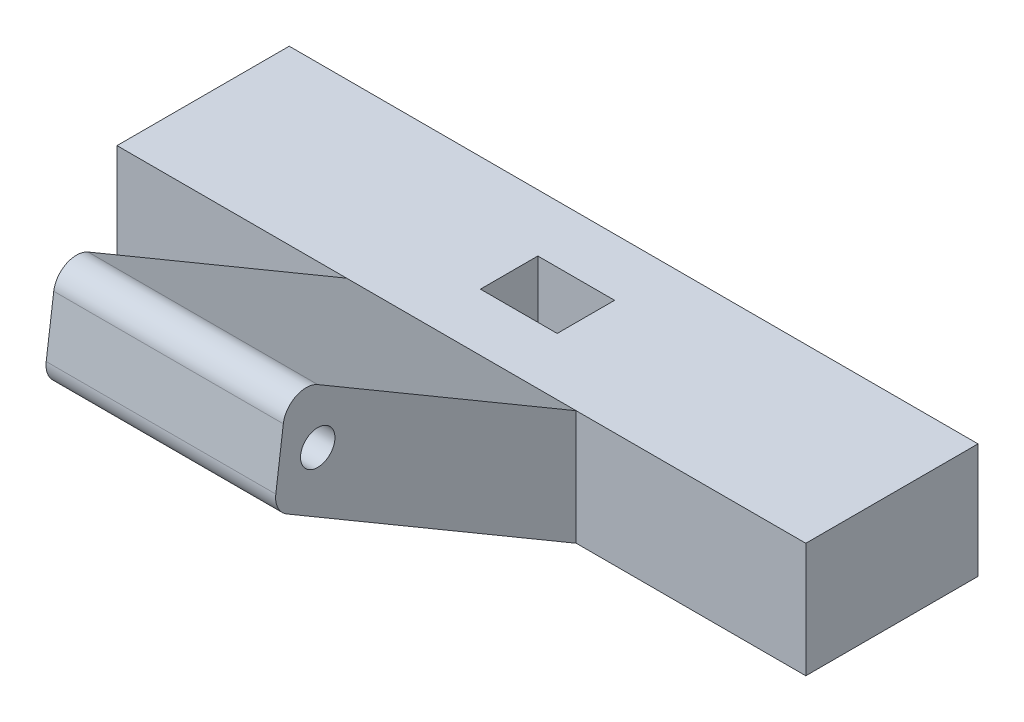
from build123d import *

# Parameters (mm, degrees)
ESQUISSE1_W             = 60
ESQUISSE1_H             = 15
ESQUISSE1_R             = 3.64432939
BOSS_EXTRU_2_DEPTH      = 10
BOSS_EXTRU_3_DEPTH      = 10
BOSS_EXTRU_3_DEPTH_BACK = 10
ESQUISSE2_R             = 1.5
ESQUISSE3_W             = 6.68566512
ESQUISSE3_H             = 5
ENL_V_MAT_EXTRU_1_DEPTH = 10
BOSS_EXTRU_5_DEPTH      = 10


with BuildPart() as part:
    # Esquisse1 → Boss.-Extru.2 (new body)
    with BuildSketch(Plane(origin=(0, 0, 0), x_dir=(1, 0, 0), z_dir=(0, 1, 0))):
        Rectangle(ESQUISSE1_W, ESQUISSE1_H)
        with Locations(Location((0, 0, 0), (0, 0, 270))):
            Circle(ESQUISSE1_R, mode=Mode.SUBTRACT)
    extrude(amount=BOSS_EXTRU_2_DEPTH)

    # Esquisse2 → Boss.-Extru.3 (add, two sides: drawn at the far end of the back side and taken through both)
    with BuildSketch(Plane(origin=(0, 0, 0), x_dir=(0, 0, -1), z_dir=(1, 0, 0)).offset(-BOSS_EXTRU_3_DEPTH_BACK)):
        with BuildLine():
            Line((-7.5, 0), (-32.699931919, 14.80760574))
            ThreePointArc((-32.699931919, 14.80760574), (-33.484005092, 15.654628224), (-33.66947754, 16.793846289))
            Line((-33.66947754, 16.793846289), (-33.012420508, 21.768308704))
            ThreePointArc((-33.012420508, 21.768308704), (-31.906962943, 23.303717227), (-30.016409528, 23.230754593))
            Line((-30.016409528, 23.230754593), (-7.5, 10))
            Line((-7.5, 10), (-7.5, 0))
        make_face()
        with Locations((-30.016409528, 18.484014396)):
            Circle(ESQUISSE2_R, mode=Mode.SUBTRACT)
    extrude(amount=BOSS_EXTRU_3_DEPTH + BOSS_EXTRU_3_DEPTH_BACK)

    # Esquisse3 → Enlèv. mat.-Extru.1 (cut)
    with BuildSketch(Plane(origin=(0, 10, 0), x_dir=(1, 0, 0), z_dir=(0, 1, 0))):
        Rectangle(ESQUISSE3_W, ESQUISSE3_H)
    extrude(amount=-ENL_V_MAT_EXTRU_1_DEPTH, mode=Mode.SUBTRACT)

    # Esquisse4 → Boss.-Extru.5 (add)
    with BuildSketch(Plane(origin=(0, 10, 0), x_dir=(1, 0, 0), z_dir=(0, 1, 0))):
        Polygon((-2.651629066, 2.5), (2.651629066, 2.5), (-0.901511212, 6.613696731), align=None)
        Polygon((-3.34283256, 1.451415578), (-3.34283256, -1.451415578), (-3.984232775, -1.229734519), (-3.663532667, 1.451415578), align=None)
        Polygon((3.34283256, 1.451415578), (3.34283256, -1.451415578), (4.44759228, -1.229734519), (3.971212027, 1.14433262), align=None)
        Polygon((2.651629066, -2.5), (-2.651629066, -2.5), (-2.371334481, -3.89686345), (1.661330759, -4.071090574), align=None)
    extrude(amount=-BOSS_EXTRU_5_DEPTH)


solid = part.part
